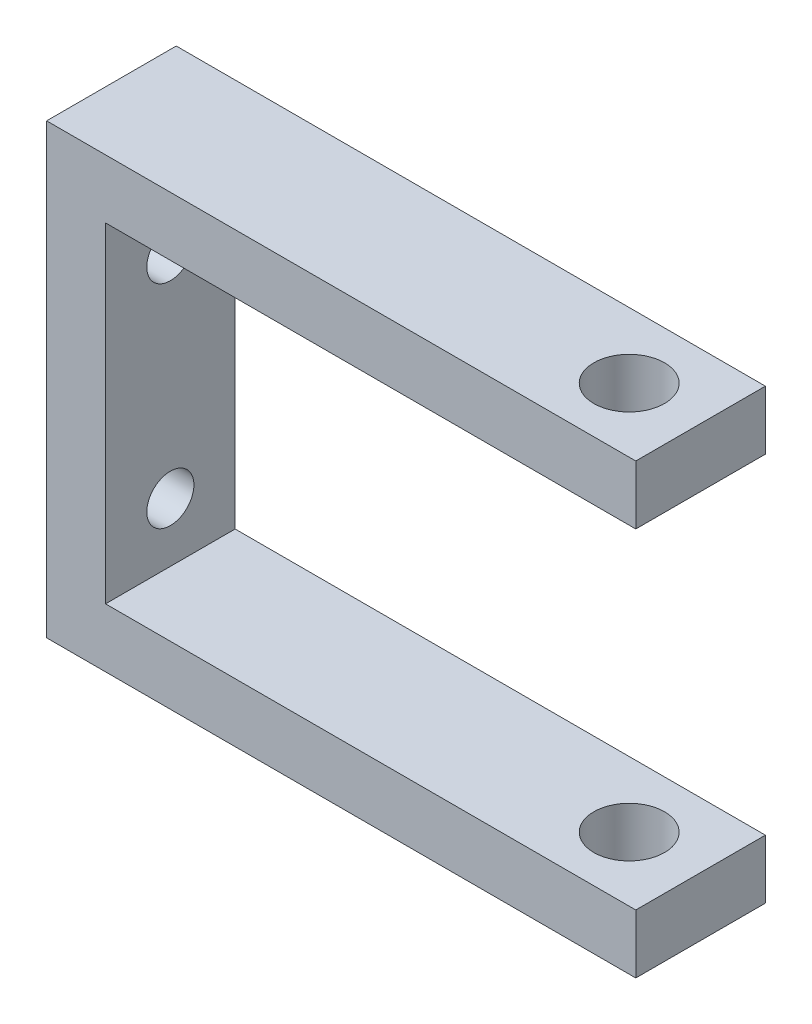
from build123d import *

# Parameters (mm, degrees)
BOSS_EXTRUDE1_DEPTH = 11
SKETCH3_R           = 3
CUT_EXTRUDE1_DEPTH  = 50
SKETCH4_R           = 2
CUT_EXTRUDE2_DEPTH  = 10


with BuildPart() as part:
    # Sketch2 → Boss-Extrude1 (new body)
    with BuildSketch(Plane.XY):
        Polygon((0, 19), (-50, 19), (-50, -19), (0, -19), (0, -14), (-45, -14), (-45, 14), (0, 14), align=None)
    extrude(amount=BOSS_EXTRUDE1_DEPTH)

    # Sketch3 → Cut-Extrude1 (cut)
    with BuildSketch(Plane(origin=(0, 19, 0), x_dir=(1, 0, 0), z_dir=(0, 1, 0))):
        with Locations(Location((-6, -5.559501776, 0), (0, 0, 180))):
            Circle(SKETCH3_R)
    extrude(amount=-CUT_EXTRUDE1_DEPTH, mode=Mode.SUBTRACT)

    # Sketch4 → Cut-Extrude2 (cut)
    with BuildSketch(Plane(origin=(-45, 0, 0), x_dir=(0, 0, -1), z_dir=(1, 0, 0))):
        with Locations((-5.5, 9)):
            Circle(SKETCH4_R)
        with Locations((-5.5, -9)):
            Circle(SKETCH4_R)
    extrude(amount=-CUT_EXTRUDE2_DEPTH, mode=Mode.SUBTRACT)


solid = part.part
